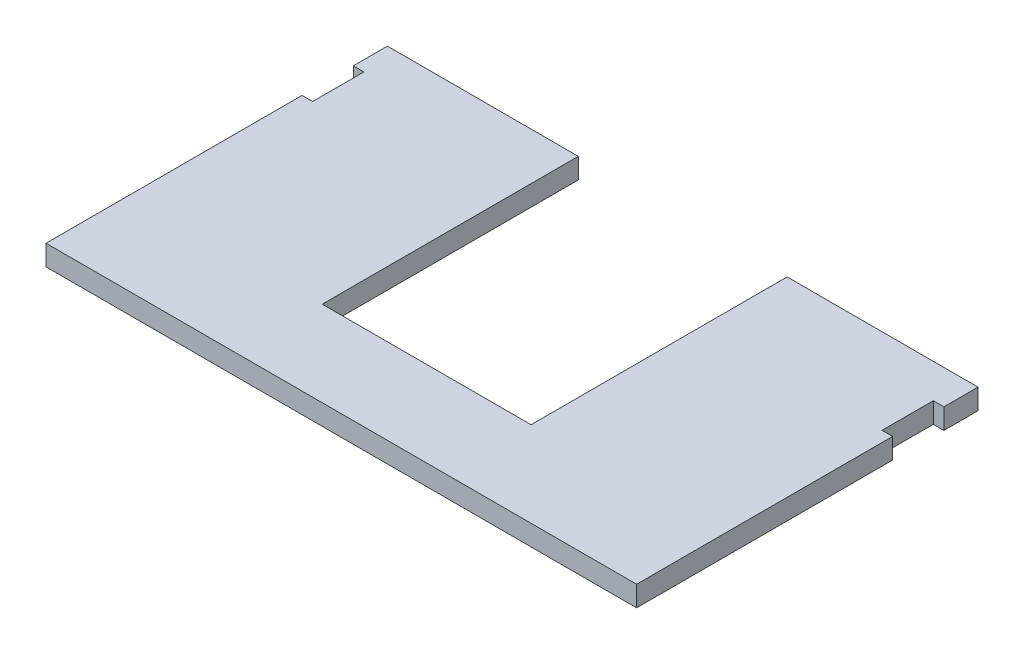
from build123d import *

# Parameters (mm, degrees)
BOSS_EXTRUDE1_DEPTH = 6


with BuildPart() as part:
    # Sketch1 → Boss-Extrude1 (new body)
    with BuildSketch(Plane(origin=(0, 0, 0), x_dir=(1, 0, 0), z_dir=(0, 1, 0))):
        Polygon((0, 0), (173, 0), (173, 75), (169.9, 75), (169.9, 90), (173, 90), (173, 100), (117.085, 100), (117.085, 25), (55.915, 25), (55.915, 100), (0, 100), (0, 90), (3.1, 90), (3.1, 75), (0, 75), align=None)
    extrude(amount=BOSS_EXTRUDE1_DEPTH)


solid = part.part
